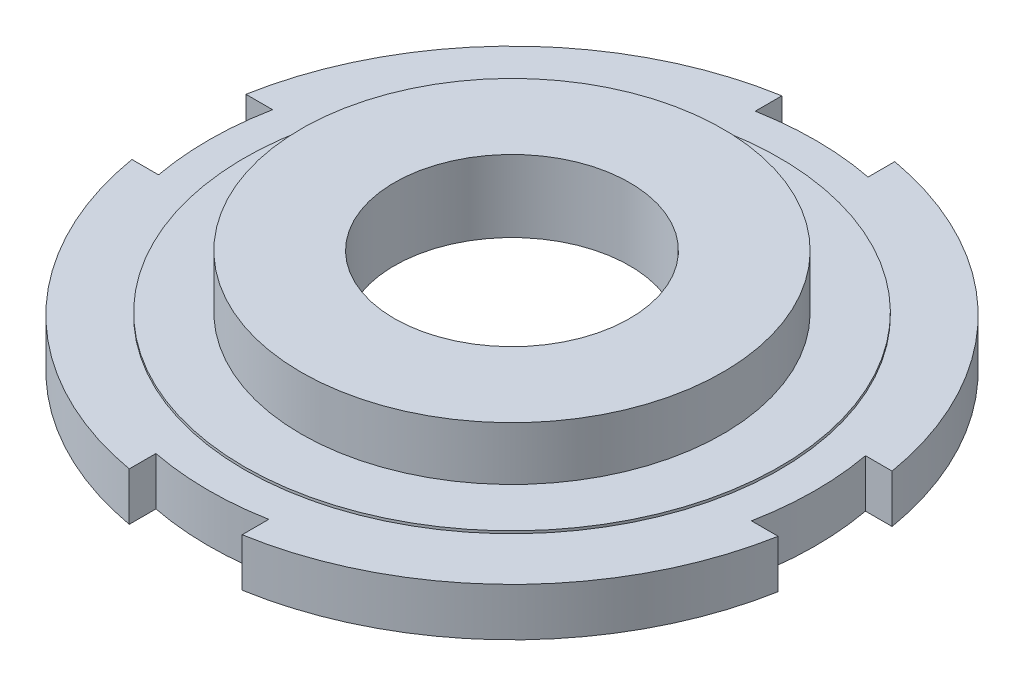
from build123d import *

# Parameters (mm, degrees)
SKETCH1_R           = 13.97
BOSS_EXTRUDE2_DEPTH = 6.0000007
CUT_EXTRUDE1_DEPTH  = 3.81
SKETCH3_R           = 31.75
CUT_EXTRUDE2_DEPTH  = 0.3
SKETCH5_R           = 25.019
SKETCH5_R_2         = 13.97
BOSS_EXTRUDE3_DEPTH = 6.35
CUT_EXTRUDE3_START  = -0.3
SKETCH6_R           = 50.8
SKETCH6_R_2         = 31.75
CUT_EXTRUDE3_DEPTH  = 0.3


with BuildPart() as part:
    # Sketch1 → Boss-Extrude2 (new body)
    with BuildSketch(Plane(origin=(0, 0, 0), x_dir=(1, 0, 0), z_dir=(0, 1, 0))):
        with BuildLine():
            Line((35.405449863, 6.5405), (38.565312338, 6.5405))
            ThreePointArc((38.565312338, 6.5405), (27.795594479, 27.522107178), (6.9215, 38.498757042))
            Line((6.9215, 38.498757042), (6.9215, 35.332942957))
            ThreePointArc((6.9215, 35.332942957), (0.19391896, 36.003977776), (-6.5405, 35.405449863))
            Line((-6.5405, 35.405449863), (-6.5405, 38.565312338))
            ThreePointArc((-6.5405, 38.565312338), (-27.522107178, 27.795594479), (-38.498757042, 6.9215))
            Line((-38.498757042, 6.9215), (-35.332942957, 6.9215))
            ThreePointArc((-35.332942957, 6.9215), (-36.003977776, 0.19391896), (-35.405449863, -6.5405))
            Line((-35.405449863, -6.5405), (-38.565312338, -6.5405))
            ThreePointArc((-38.565312338, -6.5405), (-27.795594479, -27.522107178), (-6.9215, -38.498757042))
            Line((-6.9215, -38.498757042), (-6.9215, -35.332942957))
            ThreePointArc((-6.9215, -35.332942957), (-0.19391896, -36.003977776), (6.5405, -35.405449863))
            Line((6.5405, -35.405449863), (6.5405, -38.565312338))
            ThreePointArc((6.5405, -38.565312338), (27.522107178, -27.795594479), (38.498757042, -6.9215))
            Line((38.498757042, -6.9215), (35.332942957, -6.9215))
            ThreePointArc((35.332942957, -6.9215), (36.003977776, -0.19391896), (35.405449863, 6.5405))
        make_face()
        Circle(SKETCH1_R, mode=Mode.SUBTRACT)
    extrude(amount=BOSS_EXTRUDE2_DEPTH)

    # Sketch2 → Cut-Extrude1 (cut)
    with BuildSketch(Plane.XZ):
        with BuildLine():
            Line((17.377665752, -10.033), (-0.286554615, -40.628327152))
            ThreePointArc((-0.286554615, -40.628327152), (-2.416432138, -40.557415308), (-4.539661745, -40.374924792))
            Line((-4.539661745, -40.374924792), (8.196212586, -18.315743371))
            ThreePointArc((8.196212586, -18.315743371), (-13.440862054, 14.899247741), (17.377665752, -10.033))
        make_face()
    extrude(amount=-CUT_EXTRUDE1_DEPTH, mode=Mode.SUBTRACT)

    # Sketch3 → Cut-Extrude2 (cut)
    with BuildSketch(Plane.XZ):
        Circle(SKETCH3_R)
    extrude(amount=-CUT_EXTRUDE2_DEPTH, mode=Mode.SUBTRACT)

    # Sketch5 → Boss-Extrude3 (add)
    with BuildSketch(Plane(origin=(0, 6.0000007, 0), x_dir=(1, 0, 0), z_dir=(0, 1, 0))):
        Circle(SKETCH5_R)
        Circle(SKETCH5_R_2, mode=Mode.SUBTRACT)
    extrude(amount=BOSS_EXTRUDE3_DEPTH)

    # Sketch6 → Cut-Extrude3 (cut)
    with BuildSketch(Plane(origin=(0, 6.0000007, 0), x_dir=(1, 0, 0), z_dir=(0, 1, 0)).offset(CUT_EXTRUDE3_START)):
        Circle(SKETCH6_R)
        Circle(SKETCH6_R_2, mode=Mode.SUBTRACT)
    extrude(amount=CUT_EXTRUDE3_DEPTH, mode=Mode.SUBTRACT)


solid = part.part
